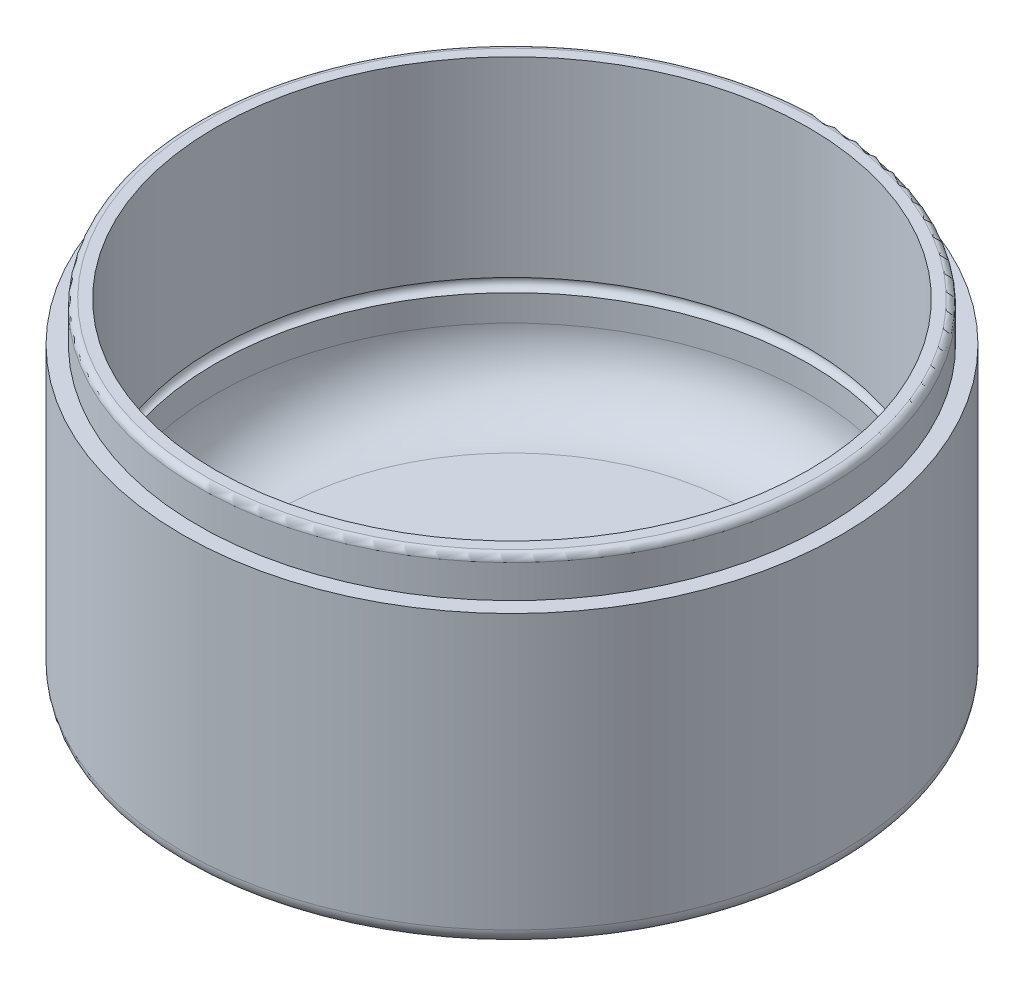
from build123d import *

# Parameters (mm, degrees)
SKETCH1_R           = 50
BOSS_EXTRUDE1_DEPTH = 50
SHELL2_T            = -5
SKETCH3_W           = 2.4
SKETCH3_H           = 6
FILLET1_R           = 1
FILLET2_R           = 10
FILLET3_R           = 2.4
SKETCH6_R           = 1


with BuildPart() as part:
    # Sketch1 → Boss-Extrude1 (new body)
    with BuildSketch(Plane(origin=(0, 0, 0), x_dir=(1, 0, 0), z_dir=(0, 1, 0))):
        with Locations(Location((0, 0, 0), (0, 0, 270))):
            Circle(SKETCH1_R)
    extrude(amount=-BOSS_EXTRUDE1_DEPTH)

    # Shell2
    shell2_openings = [part.faces().sort_by_distance(p)[0] for p in [
        (0, 0, 0),
    ]]
    offset(amount=SHELL2_T, openings=shell2_openings, kind=Kind.INTERSECTION)

    # Cut-Sweep1: sweep along a path in Sketch4
    with BuildLine(Plane(origin=(0, 0, 0), x_dir=(1, 0, 0), z_dir=(0, 1, 0))) as cut_sweep1_path:
        CenterArc((0, 0), 47.6, 0, 360)
    # Sketch3 → Cut-Sweep1 (sweep, cut)
    with BuildSketch(Plane.XY):
        with Locations((48.8, -3)):
            Rectangle(SKETCH3_W, SKETCH3_H)
    sweep(path=cut_sweep1_path.line, mode=Mode.SUBTRACT)

    # Fillet1
    fillet1_edges = [part.edges().sort_by_distance(p)[0] for p in [
        (-47.6, 0, 0),
    ]]
    fillet(fillet1_edges, radius=FILLET1_R)

    # Fillet2
    fillet2_edges = [part.edges().sort_by_distance(p)[0] for p in [
        (0, -45, -45),
    ]]
    fillet(fillet2_edges, radius=FILLET2_R)

    # Fillet3
    fillet3_edges = [part.edges().sort_by_distance(p)[0] for p in [
        (0, -50, -50),
    ]]
    fillet(fillet3_edges, radius=FILLET3_R)

    # Cut-Sweep2: sweep along a path in Sketch5
    with BuildLine(Plane(origin=(0, -30, 0), x_dir=(1, 0, 0), z_dir=(0, 1, 0))) as cut_sweep2_path:
        CenterArc((0, 0), 45, 0, 360)
    # Sketch6 → Cut-Sweep2 (sweep, cut)
    with BuildSketch(Plane.XY):
        with Locations((45, -30)):
            Circle(SKETCH6_R)
    sweep(path=cut_sweep2_path.line, mode=Mode.SUBTRACT)


solid = part.part
